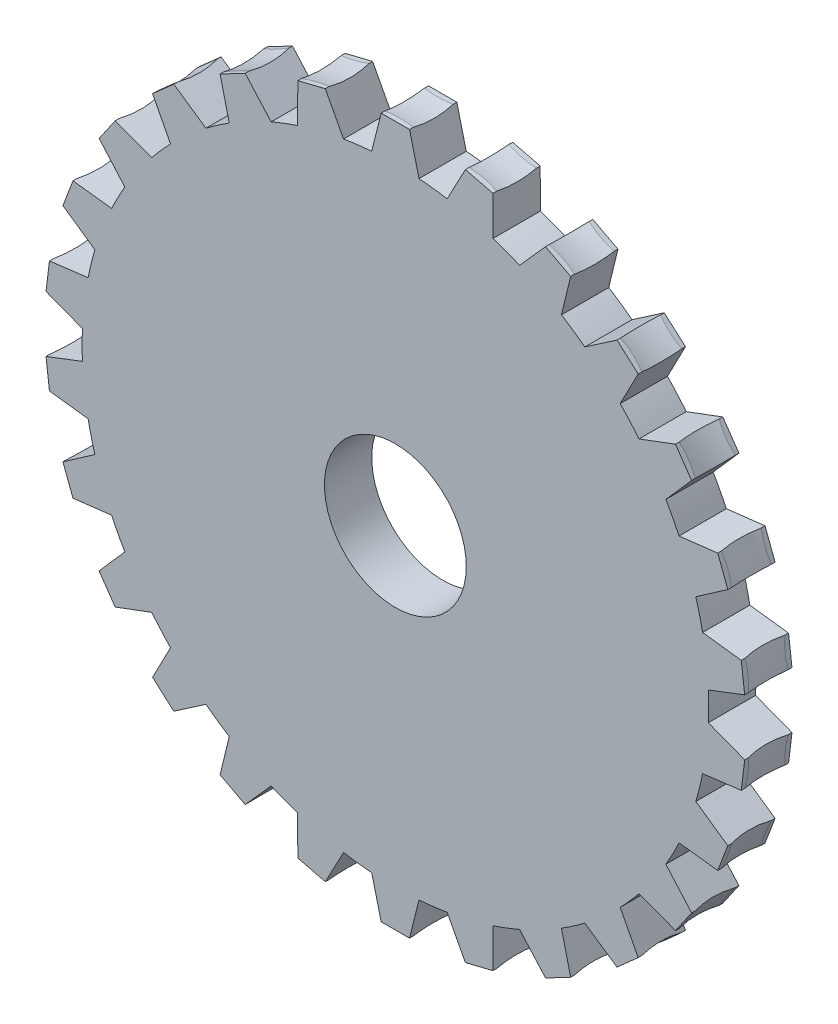
from build123d import *

# Parameters (mm, degrees)
BOSS_EXTRUDE1_DEPTH = 6.35
SKETCH2_R           = 9.525
CUT_EXTRUDE1_DEPTH  = 67.737136655


with BuildPart() as part:
    # Sketch1 → Boss-Extrude1 (new body)
    with BuildSketch(Plane.XY):
        with BuildLine():
            ThreePointArc((6.95722081, 41.493550568), (5.071311573, 41.766008417), (3.175, 41.95279532))
            Line((3.175, 41.95279532), (1.905, 47.03279532))
            Line((1.905, 47.03279532), (-1.905, 47.03279532))
            Line((-1.905, 47.03279532), (-3.175, 41.95279532))
            ThreePointArc((-3.175, 41.95279532), (-5.071311573, 41.766008417), (-6.95722081, 41.493550568))
            Line((-6.95722081, 41.493550568), (-9.406040493, 46.122004107))
            Line((-9.406040493, 46.122004107), (-13.105328817, 45.210211426))
            Line((-13.105328817, 45.210211426), (-13.122701351, 39.9738961))
            ThreePointArc((-13.122701351, 39.9738961), (-14.919208525, 39.338719821), (-16.685113236, 38.62285148))
            Line((-16.685113236, 38.62285148), (-20.170436102, 42.530769662))
            Line((-20.170436102, 42.530769662), (-23.54402356, 40.760174376))
            Line((-23.54402356, 40.760174376), (-22.307758998, 35.671859338))
            ThreePointArc((-22.307758998, 35.671859338), (-23.900055305, 34.625207819), (-25.443327528, 33.507532652))
            Line((-25.443327528, 33.507532652), (-29.762599282, 36.467801477))
            Line((-29.762599282, 36.467801477), (-32.614425232, 33.941304149))
            Line((-32.614425232, 33.941304149), (-30.196370778, 29.296703773))
            ThreePointArc((-30.196370778, 29.296703773), (-31.491917745, 27.899404597), (-32.722868106, 26.444877822))
            Line((-32.722868106, 26.444877822), (-37.625068373, 28.285457226))
            Line((-37.625068373, 28.285457226), (-39.789395058, 25.149888697))
            Line((-39.789395058, 25.149888697), (-36.330079248, 21.218930274))
            ThreePointArc((-36.330079248, 21.218930274), (-37.253584394, 19.552189389), (-38.100674534, 17.845342816))
            Line((-38.100674534, 17.845342816), (-43.300905253, 18.459265014))
            Line((-43.300905253, 18.459265014), (-44.651949873, 14.896853129))
            Line((-44.651949873, 14.896853129), (-40.352415566, 11.907989675))
            ThreePointArc((-40.352415566, 11.907989675), (-40.850208129, 10.068672004), (-41.264208247, 8.208701351))
            Line((-41.264208247, 8.208701351), (-46.460250912, 7.560287416))
            Line((-46.460250912, 7.560287416), (-46.919495663, 3.778066606))
            Line((-46.919495663, 3.778066606), (-42.029616167, 1.905))
            ThreePointArc((-42.029616167, 1.905), (-42.072766252, 0), (-42.029616167, -1.905))
            Line((-42.029616167, -1.905), (-46.919495663, -3.778066606))
            Line((-46.919495663, -3.778066606), (-46.460250912, -7.560287416))
            Line((-46.460250912, -7.560287416), (-41.264208247, -8.208701351))
            ThreePointArc((-41.264208247, -8.208701351), (-40.850208129, -10.068672004), (-40.352415566, -11.907989675))
            Line((-40.352415566, -11.907989675), (-44.651949873, -14.896853129))
            Line((-44.651949873, -14.896853129), (-43.300905253, -18.459265014))
            Line((-43.300905253, -18.459265014), (-38.100674534, -17.845342816))
            ThreePointArc((-38.100674534, -17.845342816), (-37.253584394, -19.552189389), (-36.330079248, -21.218930274))
            Line((-36.330079248, -21.218930274), (-39.789395058, -25.149888697))
            Line((-39.789395058, -25.149888697), (-37.625068373, -28.285457226))
            Line((-37.625068373, -28.285457226), (-32.722868106, -26.444877822))
            ThreePointArc((-32.722868106, -26.444877822), (-31.491917745, -27.899404597), (-30.196370778, -29.296703773))
            Line((-30.196370778, -29.296703773), (-32.614425232, -33.941304149))
            Line((-32.614425232, -33.941304149), (-29.762599282, -36.467801477))
            Line((-29.762599282, -36.467801477), (-25.443327528, -33.507532652))
            ThreePointArc((-25.443327528, -33.507532652), (-23.900055305, -34.625207819), (-22.307758998, -35.671859338))
            Line((-22.307758998, -35.671859338), (-23.54402356, -40.760174376))
            Line((-23.54402356, -40.760174376), (-20.170436102, -42.530769662))
            Line((-20.170436102, -42.530769662), (-16.685113236, -38.62285148))
            ThreePointArc((-16.685113236, -38.62285148), (-14.919208525, -39.338719821), (-13.122701351, -39.9738961))
            Line((-13.122701351, -39.9738961), (-13.105328817, -45.210211426))
            Line((-13.105328817, -45.210211426), (-9.406040493, -46.122004107))
            Line((-9.406040493, -46.122004107), (-6.95722081, -41.493550568))
            ThreePointArc((-6.95722081, -41.493550568), (-5.071311573, -41.766008417), (-3.175, -41.95279532))
            Line((-3.175, -41.95279532), (-1.905, -47.03279532))
            Line((-1.905, -47.03279532), (1.905, -47.03279532))
            Line((1.905, -47.03279532), (3.175, -41.95279532))
            ThreePointArc((3.175, -41.95279532), (5.071311573, -41.766008417), (6.95722081, -41.493550568))
            Line((6.95722081, -41.493550568), (9.406040493, -46.122004107))
            Line((9.406040493, -46.122004107), (13.105328817, -45.210211426))
            Line((13.105328817, -45.210211426), (13.122701351, -39.9738961))
            ThreePointArc((13.122701351, -39.9738961), (14.919208525, -39.338719821), (16.685113236, -38.62285148))
            Line((16.685113236, -38.62285148), (20.170436102, -42.530769662))
            Line((20.170436102, -42.530769662), (23.54402356, -40.760174376))
            Line((23.54402356, -40.760174376), (22.307758998, -35.671859338))
            ThreePointArc((22.307758998, -35.671859338), (23.900055305, -34.625207819), (25.443327528, -33.507532652))
            Line((25.443327528, -33.507532652), (29.762599282, -36.467801477))
            Line((29.762599282, -36.467801477), (32.614425232, -33.941304149))
            Line((32.614425232, -33.941304149), (30.196370778, -29.296703773))
            ThreePointArc((30.196370778, -29.296703773), (31.491917745, -27.899404597), (32.722868106, -26.444877822))
            Line((32.722868106, -26.444877822), (37.625068373, -28.285457226))
            Line((37.625068373, -28.285457226), (39.789395058, -25.149888697))
            Line((39.789395058, -25.149888697), (36.330079248, -21.218930274))
            ThreePointArc((36.330079248, -21.218930274), (37.253584394, -19.552189389), (38.100674534, -17.845342816))
            Line((38.100674534, -17.845342816), (43.300905253, -18.459265014))
            Line((43.300905253, -18.459265014), (44.651949873, -14.896853129))
            Line((44.651949873, -14.896853129), (40.352415566, -11.907989675))
            ThreePointArc((40.352415566, -11.907989675), (40.850208129, -10.068672004), (41.264208247, -8.208701351))
            Line((41.264208247, -8.208701351), (46.460250912, -7.560287416))
            Line((46.460250912, -7.560287416), (46.919495663, -3.778066606))
            Line((46.919495663, -3.778066606), (42.029616167, -1.905))
            ThreePointArc((42.029616167, -1.905), (42.072766252, 0), (42.029616167, 1.905))
            Line((42.029616167, 1.905), (46.919495663, 3.778066606))
            Line((46.919495663, 3.778066606), (46.460250912, 7.560287416))
            Line((46.460250912, 7.560287416), (41.264208247, 8.208701351))
            ThreePointArc((41.264208247, 8.208701351), (40.850208129, 10.068672004), (40.352415566, 11.907989675))
            Line((40.352415566, 11.907989675), (44.651949873, 14.896853129))
            Line((44.651949873, 14.896853129), (43.300905253, 18.459265014))
            Line((43.300905253, 18.459265014), (38.100674534, 17.845342816))
            ThreePointArc((38.100674534, 17.845342816), (37.253584394, 19.552189389), (36.330079248, 21.218930274))
            Line((36.330079248, 21.218930274), (39.789395058, 25.149888697))
            Line((39.789395058, 25.149888697), (37.625068373, 28.285457226))
            Line((37.625068373, 28.285457226), (32.722868106, 26.444877822))
            ThreePointArc((32.722868106, 26.444877822), (31.491917745, 27.899404597), (30.196370778, 29.296703773))
            Line((30.196370778, 29.296703773), (32.614425232, 33.941304149))
            Line((32.614425232, 33.941304149), (29.762599282, 36.467801477))
            Line((29.762599282, 36.467801477), (25.443327528, 33.507532652))
            ThreePointArc((25.443327528, 33.507532652), (23.900055305, 34.625207819), (22.307758998, 35.671859338))
            Line((22.307758998, 35.671859338), (23.54402356, 40.760174376))
            Line((23.54402356, 40.760174376), (20.170436102, 42.530769662))
            Line((20.170436102, 42.530769662), (16.685113236, 38.62285148))
            ThreePointArc((16.685113236, 38.62285148), (14.919208525, 39.338719821), (13.122701351, 39.9738961))
            Line((13.122701351, 39.9738961), (13.105328817, 45.210211426))
            Line((13.105328817, 45.210211426), (9.406040493, 46.122004107))
            Line((9.406040493, 46.122004107), (6.95722081, 41.493550568))
        make_face()
    extrude(amount=BOSS_EXTRUDE1_DEPTH)

    # Sketch2 → Cut-Extrude1 (cut, through all)
    with BuildSketch(Plane.XY.offset(6.35)):
        Circle(SKETCH2_R)
    extrude(amount=-CUT_EXTRUDE1_DEPTH, mode=Mode.SUBTRACT)

    # Cut-Sweep2: sweep along a path in Sketch3
    with BuildLine(Plane.XY.offset(6.35)) as cut_sweep2_path:
        CenterArc((0, 0), 47.03279532, 0, 360)
    # Sketch4 → Cut-Sweep2 (sweep, cut)
    with BuildSketch(Plane(origin=(0, 0, 0), x_dir=(0, 0, -1), z_dir=(1, 0, 0))):
        with BuildLine():
            Line((-11.114925703, 49.57279532), (4.764925703, 49.57279532))
            ThreePointArc((4.764925703, 49.57279532), (-3.175, 46.784787039), (-11.114925703, 49.57279532))
        make_face()
    sweep(path=cut_sweep2_path.line, mode=Mode.SUBTRACT)


solid = part.part
